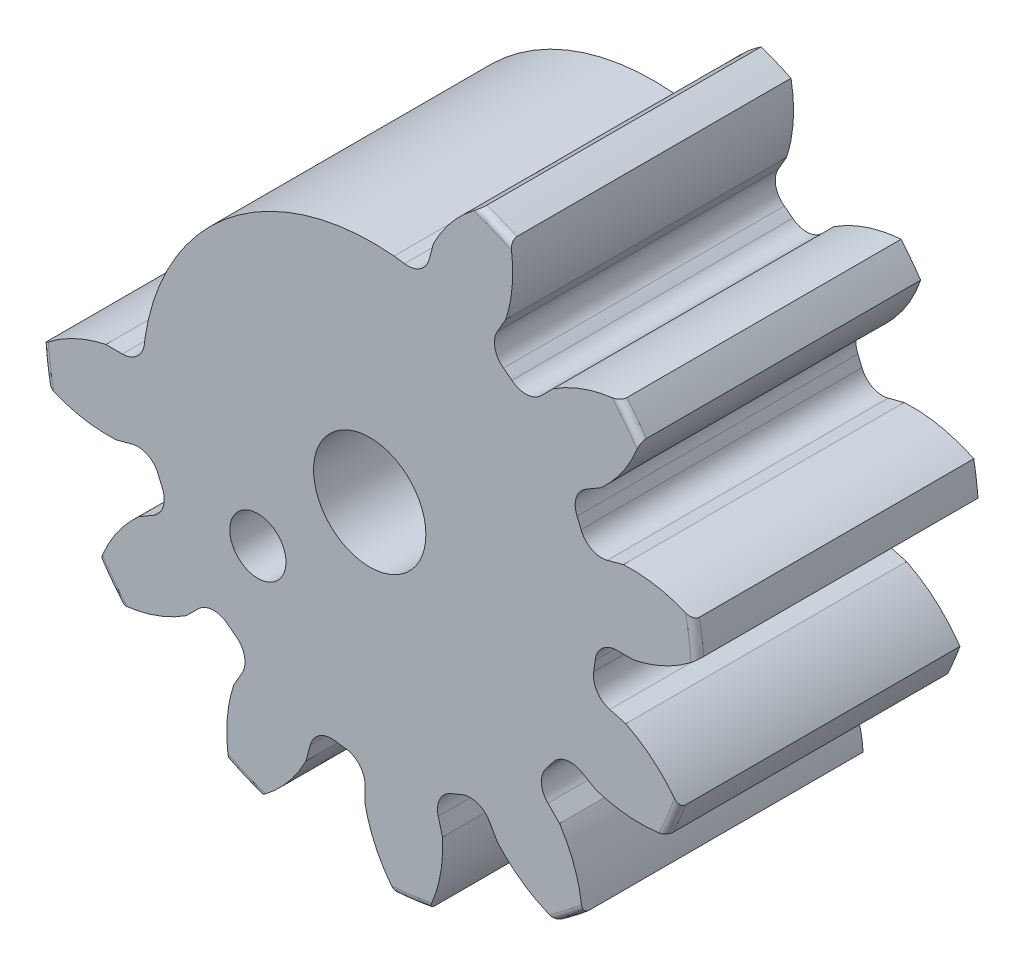
from build123d import *

# Parameters (mm, degrees)
SKETCH1_R                = 14.859
BOSS_EXTRUDE1_DEPTH      = 25.4
SKETCH2_W                = 15.748
SKETCH2_H                = 9.525
FILLET2_R                = 0.29718
CUT_EXTRUDE1_DEPTH       = 47.203221381
FILLET1_R                = 0.997458
CIRPATTERN1_COUNT        = 12
FILLET1_OF_CIRPATTERN1_R = 0.997458
SKETCH5_R                = 6.35
CUT_EXTRUDE2_DEPTH       = 47.171331337
CHAMFER1_SIZE            = 0.47625
SKETCH6_R                = 15.24
CUT_EXTRUDE3_DEPTH       = 28.448
SKETCH7_R                = 6.82625
BOSS_EXTRUDE2_DEPTH      = 12.7
SKETCH8_R                = 2.54
CUT_EXTRUDE4_DEPTH       = 12.7
SKETCH9_R                = 1.27
CUT_EXTRUDE5_DEPTH       = 12.7
CUT_EXTRUDE6_DEPTH       = 12.7


with BuildPart() as part:
    # Sketch1 → Boss-Extrude1 (new body)
    with BuildSketch(Plane.XY):
        Circle(SKETCH1_R)
    extrude(amount=-BOSS_EXTRUDE1_DEPTH)

    # Sketch2 → Revolve1 (revolve)
    with BuildSketch(Plane(origin=(0, 0, 0), x_dir=(0, 0, -1), z_dir=(1, 0, 0)), mode=Mode.PRIVATE) as revolve1_sk:
        with Locations((33.274, 4.7625)):
            Rectangle(SKETCH2_W, SKETCH2_H)
    revolve(revolve1_sk.sketch.rotate(Axis((0, 0, -25.4), (0, 0, -1)), 90), axis=Axis((0, 0, -25.4), (0, 0, -1)))

    # Fillet2
    fillet2_edges = [part.edges().sort_by_distance(p)[0] for p in [
        (-14.859, 0, 0),
        (-14.859, 0, -25.4),
        (-9.525, 0, -25.4),
    ]]
    fillet(fillet2_edges, radius=FILLET2_R)

    # Sketch4 → Cut-Extrude1 (cut, through all)
    with BuildSketch(Plane.XY):
        with BuildLine():
            Line((0.210823499, 11.932233972), (0.210823499, 10.248848528))
            ThreePointArc((0.210823499, 10.248848528), (1.338029283, 10.163317388), (2.448963421, 9.95419112))
            Line((2.448963421, 9.95419112), (2.88465663, 11.58021633))
            add(Edge.make_bspline(
                [(7.525703785, 15.115248589), (4.224610397, 14.215231808), (2.88465663, 11.58021633)],
                knots=[0, 0, 0, 1, 1, 1], degree=2))
            ThreePointArc((7.525703785, 15.115248589), (2.203954306, 16.740655387), (-3.35714731, 16.548006506))
            add(Edge.make_bspline(
                [(-3.35714731, 16.548006506), (-0.40147849, 14.824269404), (0.210823499, 11.932233972)],
                knots=[0, 0, 0, 1, 1, 1], degree=2))
        make_face()
    cut_extrude1 = extrude(amount=-CUT_EXTRUDE1_DEPTH, mode=Mode.SUBTRACT)

    # Fillet1
    fillet1_edges = [part.edges().sort_by_distance(p)[0] for p in [
        (2.448963421, 9.95419112, -12.7),
        (0.210823499, 10.248848528, -12.7),
    ]]
    fillet(fillet1_edges, radius=FILLET1_R)

    # CirPattern1: Cut-Extrude1 ×12 about axis
    cirpattern1_axis = Axis((0, 0, -25.4), (0, 0, 1))
    for i in range(1, CIRPATTERN1_COUNT):
        add(cut_extrude1.rotate(cirpattern1_axis, i * 360 / CIRPATTERN1_COUNT), mode=Mode.SUBTRACT)

    # Fillet1 of CirPattern1
    fillet1_of_cirpattern1_edges = [part.edges().sort_by_distance(p)[0] for p in [
        (-2.856231025, 9.845064095, -12.7),
        (-4.941845758, 8.981174934, -12.7),
        (-7.396100674, 7.097960096, -12.7),
        (-8.770351435, 5.30700277, -12.7),
        (-9.95419112, 2.448963421, -12.7),
        (-10.248848528, 0.210823499, -12.7),
        (-9.845064095, -2.856231025, -12.7),
        (-8.981174934, -4.941845758, -12.7),
        (-7.097960096, -7.396100674, -12.7),
        (-5.30700277, -8.770351435, -12.7),
        (-2.448963421, -9.95419112, -12.7),
        (-0.210823499, -10.248848528, -12.7),
        (2.856231025, -9.845064095, -12.7),
        (4.941845758, -8.981174934, -12.7),
        (7.396100674, -7.097960096, -12.7),
        (8.770351435, -5.30700277, -12.7),
        (9.95419112, -2.448963421, -12.7),
        (10.248848528, -0.210823499, -12.7),
        (9.845064095, 2.856231025, -12.7),
        (8.981174934, 4.941845758, -12.7),
        (7.097960096, 7.396100674, -12.7),
        (5.30700277, 8.770351435, -12.7),
    ]]
    fillet(fillet1_of_cirpattern1_edges, radius=FILLET1_OF_CIRPATTERN1_R)

    # Sketch5 → Cut-Extrude2 (cut, through all)
    with BuildSketch(Plane.XY):
        Circle(SKETCH5_R)
    extrude(amount=-CUT_EXTRUDE2_DEPTH, mode=Mode.SUBTRACT)

    # Chamfer1
    chamfer1_edges = [part.edges().sort_by_distance(p)[0] for p in [
        (-9.525, 0, -41.148),
        (-6.35, 0, -41.148),
        (-6.35, 0, 0),
    ]]
    chamfer(chamfer1_edges, length=CHAMFER1_SIZE)

    # Sketch6 → Cut-Extrude3 (cut)
    with BuildSketch(Plane(origin=(0, 0, -41.148), x_dir=(-1, 0, 0), z_dir=(0, 0, -1))):
        Circle(SKETCH6_R)
    extrude(amount=-CUT_EXTRUDE3_DEPTH, mode=Mode.SUBTRACT)

    # Sketch7 → Boss-Extrude2 (add)
    with BuildSketch(Plane.XY):
        Circle(SKETCH7_R)
    extrude(amount=-BOSS_EXTRUDE2_DEPTH)

    # Sketch8 → Cut-Extrude4 (cut)
    with BuildSketch(Plane.XY):
        Circle(SKETCH8_R)
    extrude(amount=-CUT_EXTRUDE4_DEPTH, mode=Mode.SUBTRACT)

    # Sketch9 → Cut-Extrude5 (cut)
    with BuildSketch(Plane.XY):
        with Locations((-5.058356596, -4.244084559)):
            Circle(SKETCH9_R)
    extrude(amount=-CUT_EXTRUDE5_DEPTH, mode=Mode.SUBTRACT)

    # Sketch10 → Cut-Extrude6 (cut)
    with BuildSketch(Plane.XY):
        with BuildLine():
            Line((-17.887122311, 2.402830779), (-10.163317388, 1.338029283))
            ThreePointArc((-10.163317388, 1.338029283), (-6.295587836, 8.009822123), (1.10113719, 10.19170445))
            Line((1.10113719, 10.19170445), (1.254403451, 18.004144309))
            ThreePointArc((1.254403451, 18.004144309), (-11.402283988, 13.989662619), (-17.887122311, 2.402830779))
        make_face()
    extrude(amount=-CUT_EXTRUDE6_DEPTH, mode=Mode.SUBTRACT)


solid = part.part
